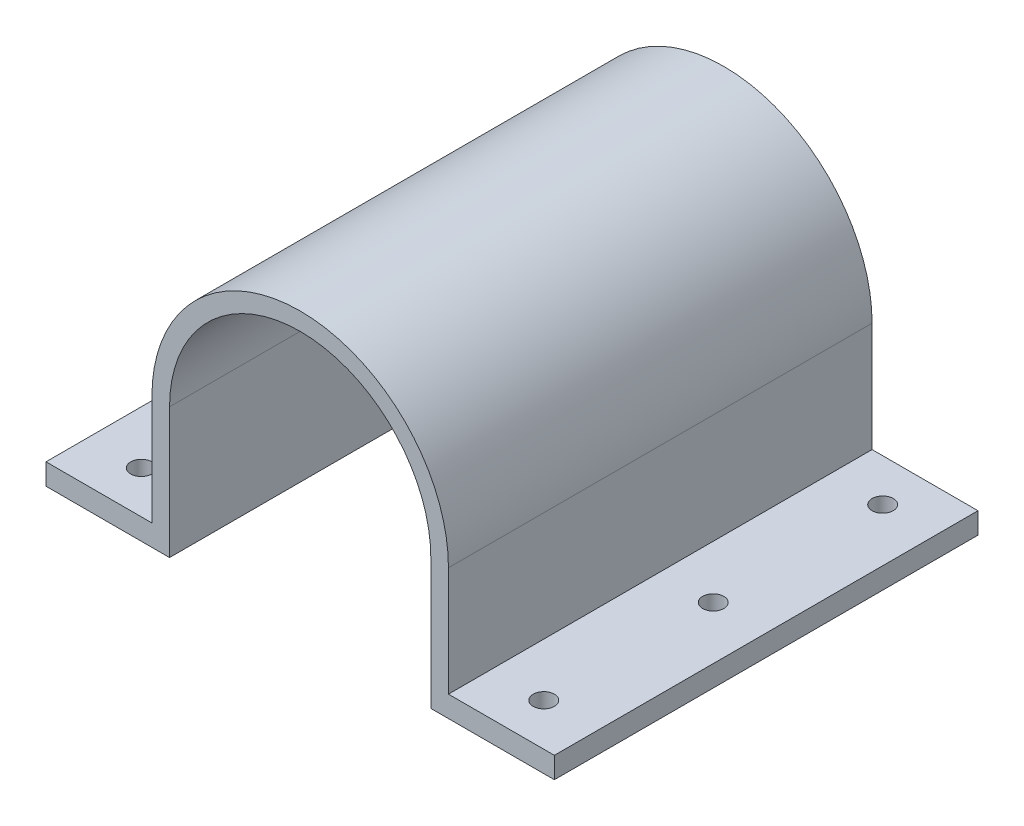
from build123d import *

# Parameters (mm, degrees)
SKETCH1_R           = 1.65
SKETCH1_R_2         = 6.15
BOSS_EXTRUDE1_DEPTH = 60
CUT_EXTRUDE1_DEPTH  = 57
SKETCH3_R           = 1.5
CUT_EXTRUDE2_DEPTH  = 79.919262541


with BuildPart() as part:
    # Sketch1 → Boss-Extrude1 (new body)
    with BuildSketch(Plane.XY):
        with BuildLine():
            Line((-21, 0), (-21, -15.5))
            Line((-21, -15.5), (-36, -15.5))
            Line((-36, -15.5), (-36, -18.5))
            Line((-36, -18.5), (36, -18.5))
            Line((36, -18.5), (36, -15.5))
            Line((36, -15.5), (21, -15.5))
            Line((21, -15.5), (21, 0))
            ThreePointArc((21, 0), (0, 21), (-21, 0))
        make_face()
        with Locations((-15.5, 0)):
            Circle(SKETCH1_R, mode=Mode.SUBTRACT)
        with Locations((-7.75, 13.423393759)):
            Circle(SKETCH1_R, mode=Mode.SUBTRACT)
        with Locations((7.75, 13.423393759)):
            Circle(SKETCH1_R, mode=Mode.SUBTRACT)
        with Locations((15.5, 0)):
            Circle(SKETCH1_R, mode=Mode.SUBTRACT)
        with Locations((7.75, -13.423393759)):
            Circle(SKETCH1_R, mode=Mode.SUBTRACT)
        with Locations((-7.75, -13.423393759)):
            Circle(SKETCH1_R, mode=Mode.SUBTRACT)
        with Locations((0, 7)):
            Circle(SKETCH1_R_2, mode=Mode.SUBTRACT)
    extrude(amount=BOSS_EXTRUDE1_DEPTH)

    # Sketch2 → Cut-Extrude1 (cut)
    with BuildSketch(Plane.XY.offset(60)):
        with BuildLine():
            Line((-18.5, 0), (-18.5, -18.5))
            Line((-18.5, -18.5), (18.5, -18.5))
            Line((18.5, -18.5), (18.5, 0))
            ThreePointArc((18.5, 0), (0, 18.5), (-18.5, 0))
        make_face()
    extrude(amount=-CUT_EXTRUDE1_DEPTH, mode=Mode.SUBTRACT)

    # Sketch3 → Cut-Extrude2 (cut, through all)
    with BuildSketch(Plane(origin=(0, -15.5, 0), x_dir=(1, 0, 0), z_dir=(0, 1, 0))):
        with Locations(Location((-28.5, -30, 0), (0, 0, 270))):
            Circle(SKETCH3_R)
        with Locations(Location((-28.5, -6, 0), (0, 0, 270))):
            Circle(SKETCH3_R)
        with Locations(Location((-28.5, -54, 0), (0, 0, 270))):
            Circle(SKETCH3_R)
        with Locations(Location((28.5, -54, 0), (0, 0, 90))):
            Circle(SKETCH3_R)
        with Locations(Location((28.5, -6, 0), (0, 0, 90))):
            Circle(SKETCH3_R)
        with Locations(Location((28.5, -30, 0), (0, 0, 90))):
            Circle(SKETCH3_R)
    extrude(amount=-CUT_EXTRUDE2_DEPTH, mode=Mode.SUBTRACT)


solid = part.part
